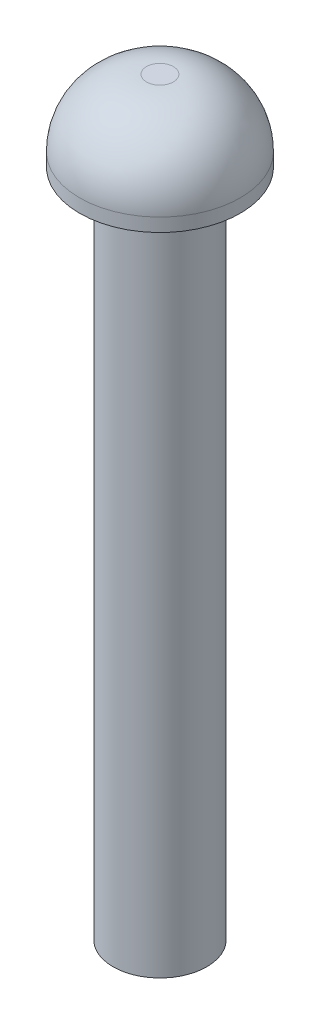
from build123d import *

# Parameters (mm, degrees)
CROQUIS1_R              = 1.75
SALIENTE_EXTRUIR1_DEPTH = 25
CROQUIS2_R              = 3
SALIENTE_EXTRUIR2_DEPTH = 3
REDONDEO1_R             = 2.5


with BuildPart() as part:
    # Croquis1 → Saliente-Extruir1 (new body)
    with BuildSketch(Plane(origin=(0, 0, 0), x_dir=(1, 0, 0), z_dir=(0, 1, 0))):
        with Locations(Location((0, 0, 0), (0, 0, 270))):
            Circle(CROQUIS1_R)
    extrude(amount=SALIENTE_EXTRUIR1_DEPTH)

    # Croquis2 → Saliente-Extruir2 (add)
    with BuildSketch(Plane(origin=(0, 25, 0), x_dir=(1, 0, 0), z_dir=(0, 1, 0))):
        with Locations(Location((0, 0, 0), (0, 0, 270))):
            Circle(CROQUIS2_R)
    extrude(amount=SALIENTE_EXTRUIR2_DEPTH)

    # Redondeo1
    redondeo1_edges = [part.edges().sort_by_distance(p)[0] for p in [
        (0, 28, -3),
    ]]
    fillet(redondeo1_edges, radius=REDONDEO1_R)


solid = part.part
